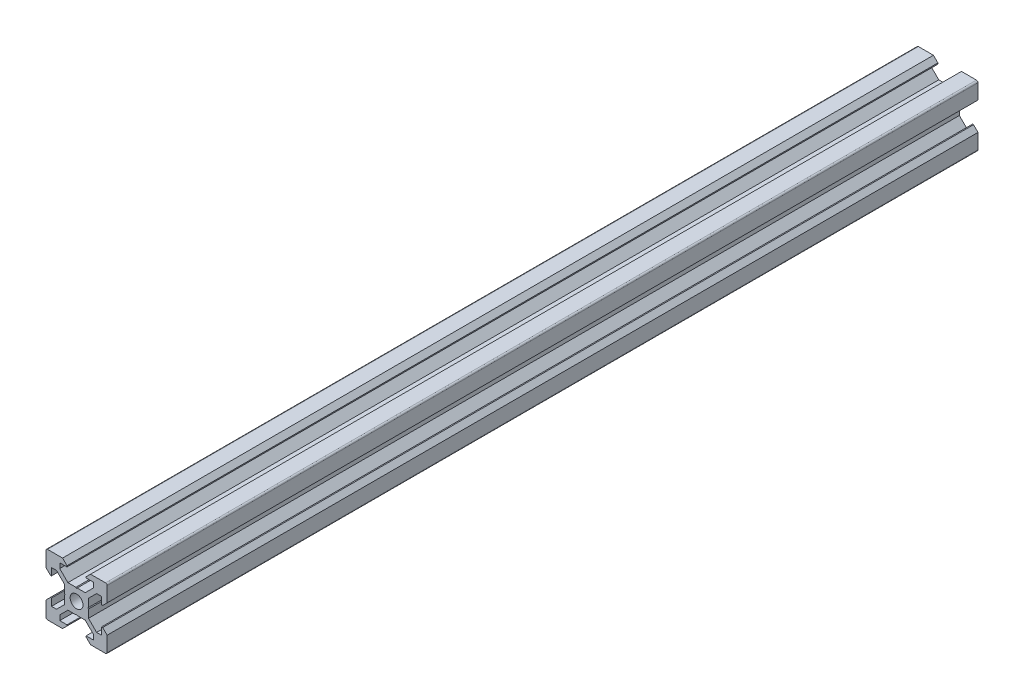
from build123d import *

# Parameters (mm, degrees)
ESBO_O1_R                = 2.1
RESSALTO_EXTRUS_O1_DEPTH = 285


with BuildPart() as part:
    # Esboço1 → Ressalto-extrusão1 (new body)
    with BuildSketch(Plane.XY):
        with BuildLine():
            Line((3.9, -0.21), (3.69, 0))
            Line((3.69, 0), (3.9, 0.21))
            Line((3.9, 0.21), (3.9, 2.839339828))
            Line((3.9, 2.839339828), (6.560660172, 5.5))
            Line((6.560660172, 5.5), (8.2, 5.5))
            Line((8.2, 5.5), (8.2, 3.125))
            Line((8.2, 3.125), (8.545, 3.125))
            Line((8.545, 3.125), (10, 4.58))
            Line((10, 4.58), (10, 9.5))
            ThreePointArc((10, 9.5), (9.853553391, 9.853553391), (9.5, 10))
            Line((9.5, 10), (4.58, 10))
            Line((4.58, 10), (3.125, 8.545))
            Line((3.125, 8.545), (3.125, 8.2))
            Line((3.125, 8.2), (5.5, 8.2))
            Line((5.5, 8.2), (5.5, 6.560660172))
            Line((5.5, 6.560660172), (2.839339828, 3.9))
            Line((2.839339828, 3.9), (0.21, 3.9))
            Line((0.21, 3.9), (0, 3.69))
            Line((0, 3.69), (-0.21, 3.9))
            Line((-0.21, 3.9), (-2.839339828, 3.9))
            Line((-2.839339828, 3.9), (-5.5, 6.560660172))
            Line((-5.5, 6.560660172), (-5.5, 8.2))
            Line((-5.5, 8.2), (-3.125, 8.2))
            Line((-3.125, 8.2), (-3.125, 8.545))
            Line((-3.125, 8.545), (-4.58, 10))
            Line((-4.58, 10), (-9.5, 10))
            ThreePointArc((-9.5, 10), (-9.853553391, 9.853553391), (-10, 9.5))
            Line((-10, 9.5), (-10, 4.58))
            Line((-10, 4.58), (-8.545, 3.125))
            Line((-8.545, 3.125), (-8.2, 3.125))
            Line((-8.2, 3.125), (-8.2, 5.5))
            Line((-8.2, 5.5), (-6.560660172, 5.5))
            Line((-6.560660172, 5.5), (-3.9, 2.839339828))
            Line((-3.9, 2.839339828), (-3.9, 0.21))
            Line((-3.9, 0.21), (-3.69, 0))
            Line((-3.69, 0), (-3.9, -0.21))
            Line((-3.9, -0.21), (-3.9, -2.839339828))
            Line((-3.9, -2.839339828), (-6.560660172, -5.5))
            Line((-6.560660172, -5.5), (-8.2, -5.5))
            Line((-8.2, -5.5), (-8.2, -3.125))
            Line((-8.2, -3.125), (-8.545, -3.125))
            Line((-8.545, -3.125), (-10, -4.58))
            Line((-10, -4.58), (-10, -9.5))
            ThreePointArc((-10, -9.5), (-9.853553391, -9.853553391), (-9.5, -10))
            Line((-9.5, -10), (-4.58, -10))
            Line((-4.58, -10), (-3.125, -8.545))
            Line((-3.125, -8.545), (-3.125, -8.2))
            Line((-3.125, -8.2), (-5.5, -8.2))
            Line((-5.5, -8.2), (-5.5, -6.560660172))
            Line((-5.5, -6.560660172), (-2.839339828, -3.9))
            Line((-2.839339828, -3.9), (-0.21, -3.9))
            Line((-0.21, -3.9), (0, -3.69))
            Line((0, -3.69), (0.21, -3.9))
            Line((0.21, -3.9), (2.839339828, -3.9))
            Line((2.839339828, -3.9), (5.5, -6.560660172))
            Line((5.5, -6.560660172), (5.5, -8.2))
            Line((5.5, -8.2), (3.125, -8.2))
            Line((3.125, -8.2), (3.125, -8.545))
            Line((3.125, -8.545), (4.58, -10))
            Line((4.58, -10), (9.5, -10))
            ThreePointArc((9.5, -10), (9.853553391, -9.853553391), (10, -9.5))
            Line((10, -9.5), (10, -4.58))
            Line((10, -4.58), (8.545, -3.125))
            Line((8.545, -3.125), (8.2, -3.125))
            Line((8.2, -3.125), (8.2, -5.5))
            Line((8.2, -5.5), (6.560660172, -5.5))
            Line((6.560660172, -5.5), (3.9, -2.839339828))
            Line((3.9, -2.839339828), (3.9, -0.21))
        make_face()
        Circle(ESBO_O1_R, mode=Mode.SUBTRACT)
    extrude(amount=RESSALTO_EXTRUS_O1_DEPTH)


solid = part.part
